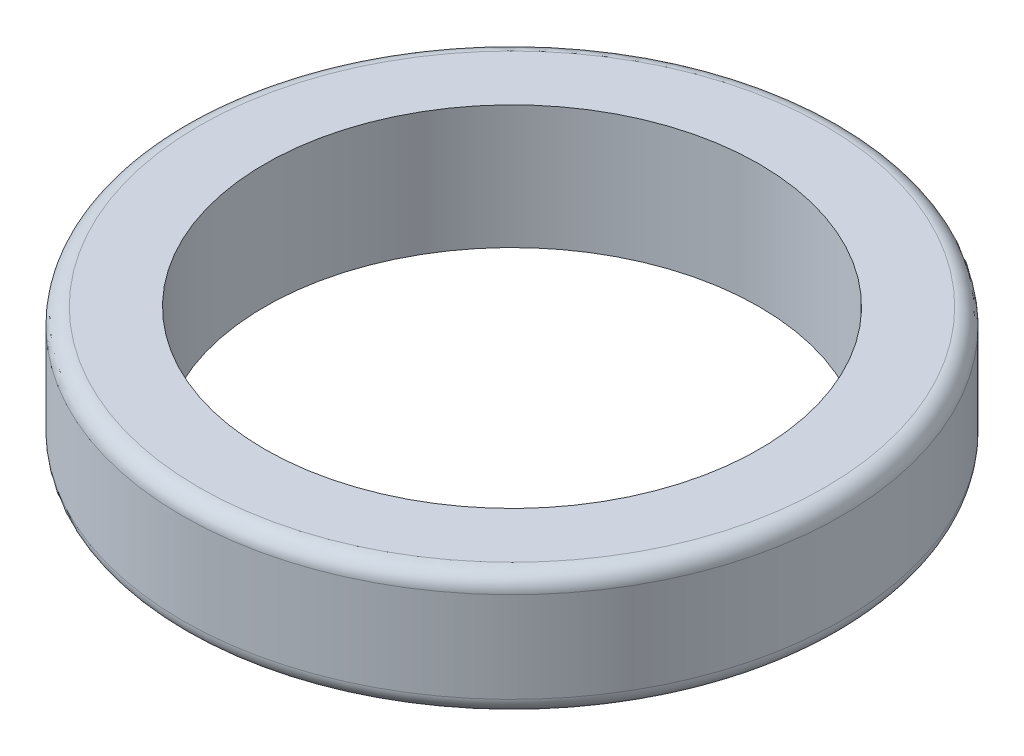
from build123d import *

# Parameters (mm, degrees)
SKIZZE1_R                       = 4
SKIZZE1_R_2                     = 3
AUFSATZ_LINEAR_AUSTRAGEN1_DEPTH = 1.5
VERRUNDUNG1_R                   = 0.2


with BuildPart() as part:
    # Skizze1 → Aufsatz-Linear austragen1 (new body)
    with BuildSketch(Plane(origin=(0, 0, 0), x_dir=(1, 0, 0), z_dir=(0, 1, 0))):
        with Locations(Location((0, 0, 0), (0, 0, 270))):
            Circle(SKIZZE1_R)
        with Locations(Location((0, 0, 0), (0, 0, 270))):
            Circle(SKIZZE1_R_2, mode=Mode.SUBTRACT)
    extrude(amount=AUFSATZ_LINEAR_AUSTRAGEN1_DEPTH)

    # Verrundung1
    verrundung1_edges = [part.edges().sort_by_distance(p)[0] for p in [
        (0, 0, -4),
        (0, 1.5, -4),
    ]]
    fillet(verrundung1_edges, radius=VERRUNDUNG1_R)


solid = part.part
